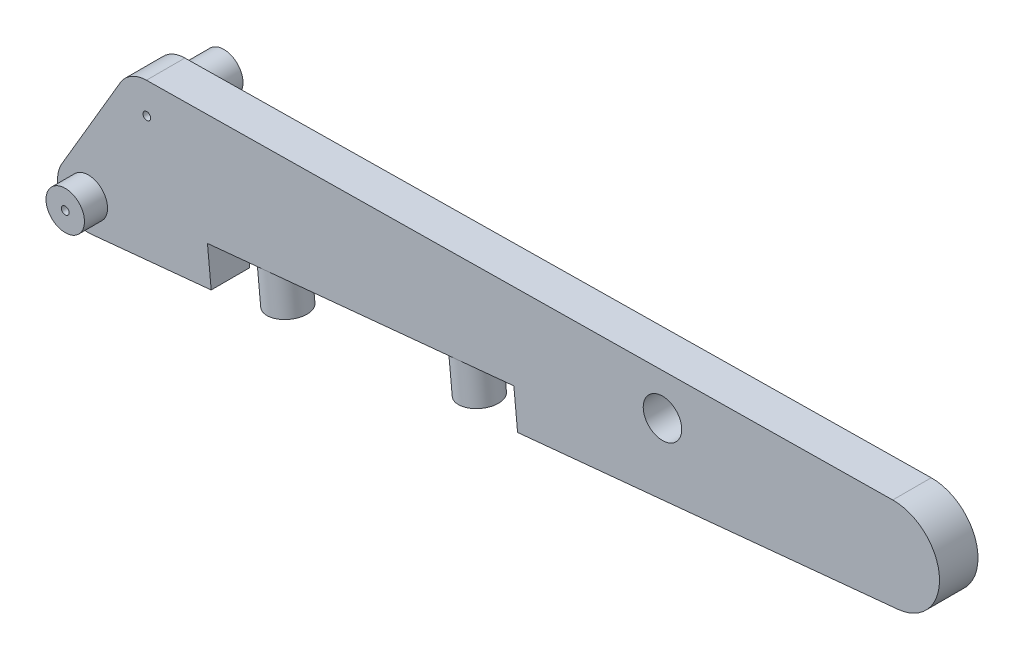
from build123d import *

# Parameters (mm, degrees)
SKETCH3_R           = 2.5
BOSS_EXTRUDE1_DEPTH = 5
BOSS_EXTRUDE2_START = -10
SKETCH4_R           = 2.5
SKETCH4_R_2         = 0.5
BOSS_EXTRUDE2_DEPTH = 10
SKETCH5_R           = 2.5
SKETCH5_R_2         = 0.5
BOSS_EXTRUDE3_DEPTH = 8
SKETCH6_R           = 2.5
CUT_EXTRUDE1_DEPTH  = 5
CUT_EXTRUDE2_DEPTH  = 5
SKETCH8_R           = 2.5
SKETCH8_R_2         = 0.5
BOSS_EXTRUDE4_DEPTH = 5


with BuildPart() as part:
    # Sketch3 → Boss-Extrude1 (new body)
    with BuildSketch(Plane.XY):
        with BuildLine():
            Line((-11.048388083, -10.905646279), (-3.448601602, 2.026609728))
            ThreePointArc((-3.448601602, 2.026609728), (-2.00903777, 3.458867913), (-0.051681177, 3.999666118))
            Line((-0.051681177, 3.999666118), (96.922478234, 5.252705394))
            ThreePointArc((96.922478234, 5.252705394), (102.990943647, -0.417257421), (97.580968918, -6.718600471))
            Line((97.580968918, -6.718600471), (-7.212473869, -16.913460466))
            ThreePointArc((-7.212473869, -16.913460466), (-10.971185359, -15.084852023), (-11.048388083, -10.905646279))
        make_face()
        with Locations((-7.599786481, -12.932256007)):
            Circle(SKETCH3_R, mode=Mode.SUBTRACT)
        Circle(SKETCH3_R, mode=Mode.SUBTRACT)
    extrude(amount=BOSS_EXTRUDE1_DEPTH)

    # Sketch4 → Boss-Extrude2 (add)
    with BuildSketch(Plane.XY.offset(5).offset(BOSS_EXTRUDE2_START)):
        Circle(SKETCH4_R)
        Circle(SKETCH4_R_2, mode=Mode.SUBTRACT)
    extrude(amount=BOSS_EXTRUDE2_DEPTH)

    # Sketch5 → Boss-Extrude3 (add)
    with BuildSketch(Plane(origin=(0, 0, 0), x_dir=(-1, 0, 0), z_dir=(0, 0, -1))):
        with Locations((7.599786481, -12.932256007)):
            Circle(SKETCH5_R)
        with Locations((7.599786481, -12.932256007)):
            Circle(SKETCH5_R_2, mode=Mode.SUBTRACT)
    extrude(amount=-BOSS_EXTRUDE3_DEPTH)

    # Sketch6 → Cut-Extrude1 (cut)
    with BuildSketch(Plane(origin=(0, 0, 0), x_dir=(-1, 0, 0), z_dir=(0, 0, -1))):
        with Locations((-67, -0.515826634)):
            Circle(SKETCH6_R)
    extrude(amount=-CUT_EXTRUDE1_DEPTH, mode=Mode.SUBTRACT)

    # Sketch7 → Cut-Extrude2 (cut)
    with BuildSketch(Plane(origin=(0, 0, 0), x_dir=(-1, 0, 0), z_dir=(0, 0, -1))):
        Polygon((-48.17552087, -11.525023587), (-8.363476285, -15.398149709), (-7.877049858, -10.398149709), (-47.689094443, -6.525023587), align=None)
    extrude(amount=-CUT_EXTRUDE2_DEPTH, mode=Mode.SUBTRACT)

    # Sketch8 → Boss-Extrude4 (add)
    # profile 1 of 2: a face of its own
    with BuildSketch(Plane(origin=(1.075955423, -11.059796122, 0), x_dir=(0.9953011146267038, 0.09682815304879674, 0), z_dir=(0.09682815304879674, -0.9953011146267039, 0))):
        with Locations(Location((14.333202872, 2.5, 0), (0, 0, 90))):
            Circle(SKETCH8_R)
        with Locations((14.333202872, 2.5)):
            Circle(SKETCH8_R_2, mode=Mode.SUBTRACT)
    # profile 2 of 2: a face of its own
    with BuildSketch(Plane(origin=(1.075955423, -11.059796122, 0), x_dir=(0.9953011146267038, 0.09682815304879674, 0), z_dir=(0.09682815304879674, -0.9953011146267039, 0))):
        with Locations(Location((39.333202872, 2.5, 0), (0, 0, 270))):
            Circle(SKETCH8_R)
        with Locations((39.333202872, 2.5)):
            Circle(SKETCH8_R_2, mode=Mode.SUBTRACT)
    extrude(amount=BOSS_EXTRUDE4_DEPTH)


solid = part.part
